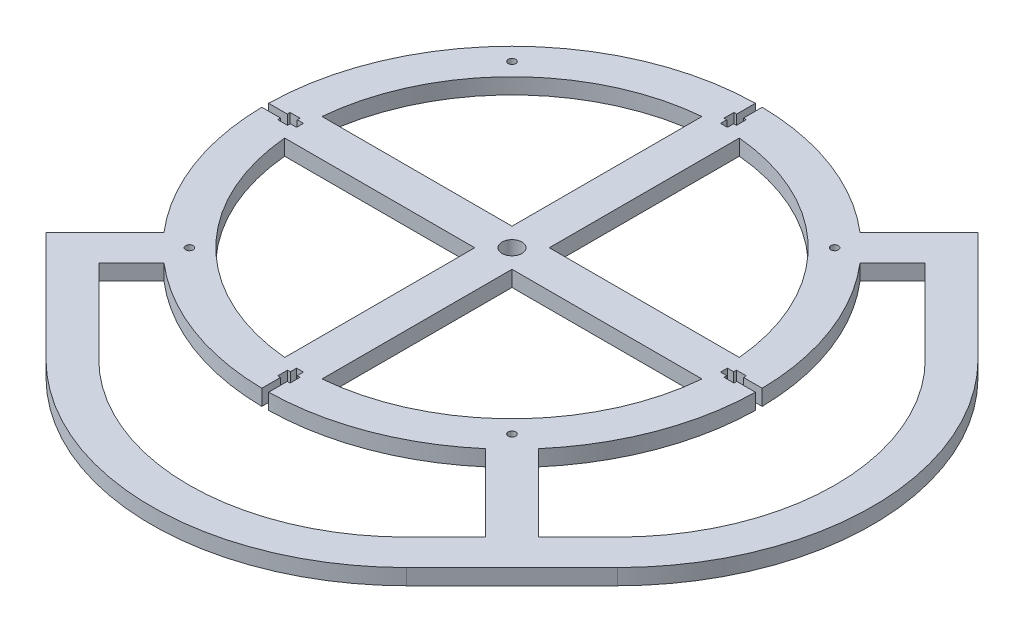
from build123d import *

# Parameters (mm, degrees)
BOSS_EXTRUDE1_DEPTH          = 3.175
SKETCH2_W                    = 2.75
SKETCH2_H                    = 2.5
SKETCH2_H_2                  = 4
SKETCH2_W_2                  = 1.125
SKETCH2_H_3                  = 7.5
CUT_EXTRUDE1_DEPTH           = 230.978807609
CIRPATTERN1_COUNT            = 4
F_3_0_3_DIAMETER_HOLE1_D     = 3
F_8_0_8_DIAMETER_HOLE1_D     = 8
F_8_0_8_DIAMETER_HOLE1_DEPTH = 6.35


with BuildPart() as part:
    # Sketch1 → Boss-Extrude1 (new, symmetric)
    with BuildSketch(Plane(origin=(0, 0, 0), x_dir=(1, 0, 0), z_dir=(0, 1, 0))):
        with BuildLine():
            Line((88.388347648, 98.994949366), (64.667874078, 75.274475795))
            ThreePointArc((64.667874078, 75.274475795), (-70.171862751, 70.171862751), (-75.274475795, -64.667874078))
            Line((-75.274475795, -64.667874078), (-98.994949366, -88.388347648))
            Line((-98.994949366, -88.388347648), (-54.800775542, -132.582521472))
            ThreePointArc((-54.800775542, -132.582521472), (17.67766953, -162.604076401), (90.156114601, -132.582521472))
            Line((90.156114601, -132.582521472), (132.582521472, -90.156114601))
            ThreePointArc((132.582521472, -90.156114601), (162.604076401, -17.67766953), (132.582521472, 54.800775542))
            Line((132.582521472, 54.800775542), (88.388347648, 98.994949366))
        make_face()
        with BuildLine():
            Line((-7.5, -7.5), (-7.5, -83.903460262))
            ThreePointArc((-7.5, -83.903460262), (-59.565261034, -59.565261034), (-83.903460262, -7.5))
            Line((-83.903460262, -7.5), (-7.5, -7.5))
        make_face(mode=Mode.SUBTRACT)
        with BuildLine():
            ThreePointArc((83.903460262, -7.5), (59.565261034, -59.565261034), (7.5, -83.903460262))
            Line((7.5, -83.903460262), (7.5, -7.5))
            Line((7.5, -7.5), (83.903460262, -7.5))
        make_face(mode=Mode.SUBTRACT)
        with BuildLine():
            ThreePointArc((-64.667874078, -75.274475795), (0, -99.238), (64.667874078, -75.274475795))
            Line((64.667874078, -75.274475795), (95.45941546, -106.066017178))
            Line((95.45941546, -106.066017178), (79.549512883, -121.975919755))
            ThreePointArc((79.549512883, -121.975919755), (17.67766953, -147.604076401), (-44.194173824, -121.975919755))
            Line((-44.194173824, -121.975919755), (-77.781745931, -88.388347648))
            Line((-77.781745931, -88.388347648), (-64.667874078, -75.274475795))
        make_face(mode=Mode.SUBTRACT)
        with BuildLine():
            ThreePointArc((75.274475795, -64.667874078), (99.238, 0), (75.274475795, 64.667874078))
            Line((75.274475795, 64.667874078), (88.388347648, 77.781745931))
            Line((88.388347648, 77.781745931), (121.975919755, 44.194173824))
            ThreePointArc((121.975919755, 44.194173824), (147.604076401, -17.67766953), (121.975919755, -79.549512883))
            Line((121.975919755, -79.549512883), (106.066017178, -95.45941546))
            Line((106.066017178, -95.45941546), (75.274475795, -64.667874078))
        make_face(mode=Mode.SUBTRACT)
        with BuildLine():
            Line((-7.5, 7.5), (-83.903460262, 7.5))
            ThreePointArc((-83.903460262, 7.5), (-59.565261034, 59.565261034), (-7.5, 83.903460262))
            Line((-7.5, 83.903460262), (-7.5, 7.5))
        make_face(mode=Mode.SUBTRACT)
        with BuildLine():
            ThreePointArc((7.5, 83.903460262), (59.565261034, 59.565261034), (83.903460262, 7.5))
            Line((83.903460262, 7.5), (7.5, 7.5))
            Line((7.5, 7.5), (7.5, 83.903460262))
        make_face(mode=Mode.SUBTRACT)
    extrude(amount=BOSS_EXTRUDE1_DEPTH, both=True)

    # Sketch2 → Cut-Extrude1 (cut, symmetric)
    with BuildSketch(Plane(origin=(0, 0, 0), x_dir=(1, 0, 0), z_dir=(0, 1, 0))):
        with Locations((0, 86.488)):
            Rectangle(SKETCH2_W, SKETCH2_H)
        with Locations((0, 89.738)):
            Rectangle(SKETCH2_W, SKETCH2_H_2)
        with Locations((1.9375, 89.738)):
            Rectangle(SKETCH2_W_2, SKETCH2_H_2)
        with Locations((0, 95.488)):
            Rectangle(SKETCH2_W, SKETCH2_H_3)
        with Locations((-1.9375, 89.738)):
            Rectangle(SKETCH2_W_2, SKETCH2_H_2)
    cut_extrude1 = extrude(amount=CUT_EXTRUDE1_DEPTH, both=True, mode=Mode.SUBTRACT)

    # CirPattern1: Cut-Extrude1 ×4 about axis
    cirpattern1_axis = Axis((0, 0, 0), (0, 1, 0))
    for i in range(1, CIRPATTERN1_COUNT):
        add(cut_extrude1.rotate(cirpattern1_axis, i * 360 / CIRPATTERN1_COUNT), mode=Mode.SUBTRACT)

    # Ø3.0 (3) Diameter Hole1 (through all)
    with Locations(Plane(origin=(0, 3.175, 0), x_dir=(1, 0, 0), z_dir=(0, 1, 0))):
        with Locations((-64.868561892, -64.868561892), (0, 0), (-64.868561892, 64.868561892), (64.868561892, 64.868561892), (64.868561892, -64.868561892)):
            Hole(F_3_0_3_DIAMETER_HOLE1_D / 2)

    # Ø8.0 (8) Diameter Hole1
    with Locations(Plane(origin=(0, 3.175, 0), x_dir=(1, 0, 0), z_dir=(0, 1, 0))):
        with Locations((0, 0)):
            Hole(F_8_0_8_DIAMETER_HOLE1_D / 2, depth=F_8_0_8_DIAMETER_HOLE1_DEPTH)


solid = part.part
